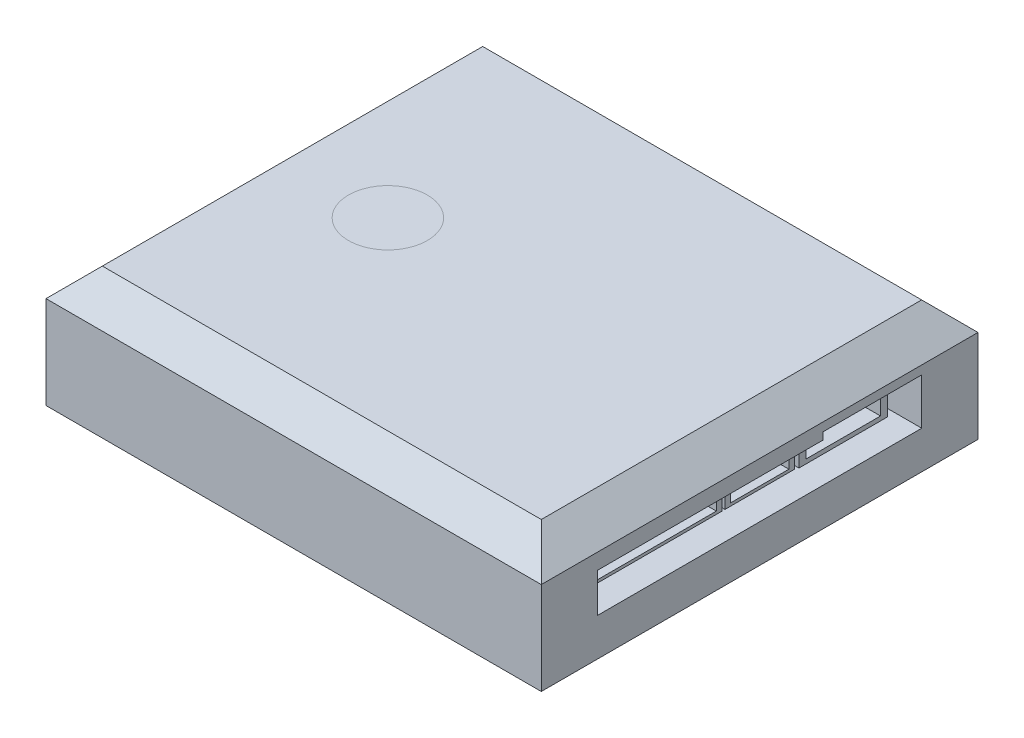
from build123d import *

# Parameters (mm, degrees)
SKETCH1_W            = 43.95
SKETCH1_H            = 38.75
BOSS_EXTRUDE1_DEPTH  = 12.4968
CHAMFER1_SIZE        = 2.5
CHAMFER2_SIZE        = 1.778
SKETCH2_W            = 28.7655
SKETCH2_H            = 3.4671
SKETCH2_W_2          = 8.763
SKETCH2_H_2          = 0.635
CUT_EXTRUDE1_DEPTH   = 6.9342
SKETCH3_W            = 12.5476
SKETCH3_H            = 3.0099
SKETCH3_W_2          = 6.1849
SKETCH3_W_3          = 7.874
SKETCH3_H_2          = 3.8481
BOSS_EXTRUDE2_DEPTH  = 4.6736
CUT_EXTRUDE3_START   = 1.27
CUT_EXTRUDE3_DEPTH   = 3.4036
SKETCH4_R            = 0.1905
SKETCH4_R_2          = 0.254
PINS_DEPTH           = 3.0226
SKETCH6_W            = 4.980118903
SKETCH6_H            = 2.927945053
SKETCH6_W_2          = 6.188094789
CUT_EXTRUDE4_DEPTH   = 7.366
BOSS_EXTRUDE6_START  = -2.286
SKETCH6_7_W          = 4.980118903
SKETCH6_7_H          = 2.927945053
SKETCH6_7_W_2        = 6.188094789
BOSS_EXTRUDE6_DEPTH  = 7.366
BOSS_EXTRUDE7_START  = -5.08
BOSS_EXTRUDE7_DEPTH  = 1.27
SKETCH7_R            = 0.1905
BOSS_EXTRUDE8_DEPTH  = 1.524
SKETCH8_W            = 27.697495277
SKETCH8_H            = 4.307026778
SKETCH8_W_2          = 8.315874778
SKETCH8_H_2          = 3.037026778
SKETCH8_W_3          = 6.16236139
SKETCH8_W_4          = 8.647259109
CUT_EXTRUDE5_DEPTH   = 7.170409787
BOSS_EXTRUDE9_START  = -2.286
SKETCH8_3_W          = 8.315874778
SKETCH8_3_H          = 3.037026778
SKETCH8_3_W_2        = 6.16236139
SKETCH8_3_W_3        = 8.647259109
BOSS_EXTRUDE9_DEPTH  = 4.884409787
BOSS_EXTRUDE10_START = -7.112
BOSS_EXTRUDE10_DEPTH = 1.27
SKETCH9_R            = 0.1905
BOSS_EXTRUDE11_DEPTH = 3.302


with BuildPart() as part:
    # Sketch1 → Boss-Extrude1 (new body)
    with BuildSketch(Plane(origin=(0, 0, 0), x_dir=(1, 0, 0), z_dir=(0, 1, 0))):
        Rectangle(SKETCH1_W, SKETCH1_H)
    extrude(amount=BOSS_EXTRUDE1_DEPTH)

    # Chamfer1
    chamfer1_edges = [part.edges().sort_by_distance(p)[0] for p in [
        (-21.975, 12.4968, 0),
        (0, 12.4968, 19.375),
        (21.975, 12.4968, 0),
        (0, 12.4968, -19.375),
    ]]
    chamfer(chamfer1_edges, length=CHAMFER1_SIZE)

    # Chamfer2
    chamfer2_edges = [part.edges().sort_by_distance(p)[0] for p in [
        (0, 0, 19.375),
        (-21.975, 0, 0),
        (0, 0, -19.375),
        (21.975, 0, 0),
    ]]
    chamfer(chamfer2_edges, length=CHAMFER2_SIZE)

    # Sketch2 → Cut-Extrude1 (cut)
    with BuildSketch(Plane(origin=(21.975, 0, 0), x_dir=(0, 0, -1), z_dir=(1, 0, 0))):
        with Locations((0, 6.86625)):
            Rectangle(SKETCH2_W, SKETCH2_H)
        with Locations((10.00125, 8.9173)):
            Rectangle(SKETCH2_W_2, SKETCH2_H_2)
    extrude(amount=-CUT_EXTRUDE1_DEPTH, mode=Mode.SUBTRACT)

    # Sketch3 → Boss-Extrude2 (add)
    # profile 1 of 6: a face of its own
    with BuildSketch(Plane(origin=(15.0408, 0, 0), x_dir=(0, 0, -1), z_dir=(1, 0, 0))):
        with Locations((-7.34695, 6.86625)):
            Rectangle(SKETCH3_W, SKETCH3_H)
        Polygon((-13.11275, 7.1012), (-13.11275, 5.6153), (-1.58115, 5.6153), (-1.58115, 7.1012), (-1.32715, 7.1012), (-1.32715, 7.6092), (-1.58115, 7.6092), (-1.58115, 8.1172), (-13.11275, 8.1172), (-13.11275, 7.6092), (-13.36675, 7.6092), (-13.36675, 7.1012), align=None, mode=Mode.SUBTRACT)
    # profile 2 of 6: a face of its own
    with BuildSketch(Plane(origin=(15.0408, 0, 0), x_dir=(0, 0, -1), z_dir=(1, 0, 0))):
        Polygon((-13.11275, 7.1012), (-13.36675, 7.1012), (-13.36675, 7.6092), (-13.11275, 7.6092), (-13.11275, 8.1172), (-1.58115, 8.1172), (-1.58115, 7.6092), (-1.32715, 7.6092), (-1.32715, 7.1012), (-1.58115, 7.1012), (-1.58115, 5.6153), (-13.11275, 5.6153), align=None)
    # profile 3 of 6: a face of its own
    with BuildSketch(Plane(origin=(15.0408, 0, 0), x_dir=(0, 0, -1), z_dir=(1, 0, 0))):
        with Locations((2.2733, 6.86625)):
            Rectangle(SKETCH3_W_2, SKETCH3_H)
        Polygon((-0.31115, 7.1012), (-0.31115, 5.6153), (4.85775, 5.6153), (4.85775, 7.1012), (5.11175, 7.1012), (5.11175, 7.6092), (4.85775, 7.6092), (4.85775, 8.1172), (-0.31115, 8.1172), (-0.31115, 7.6092), (-0.56515, 7.6092), (-0.56515, 7.1012), align=None, mode=Mode.SUBTRACT)
    # profile 4 of 6: a face of its own
    with BuildSketch(Plane(origin=(15.0408, 0, 0), x_dir=(0, 0, -1), z_dir=(1, 0, 0))):
        Polygon((-0.31115, 7.1012), (-0.56515, 7.1012), (-0.56515, 7.6092), (-0.31115, 7.6092), (-0.31115, 8.1172), (4.85775, 8.1172), (4.85775, 7.6092), (5.11175, 7.6092), (5.11175, 7.1012), (4.85775, 7.1012), (4.85775, 5.6153), (-0.31115, 5.6153), align=None)
    # profile 5 of 6: a face of its own
    with BuildSketch(Plane(origin=(15.0408, 0, 0), x_dir=(0, 0, -1), z_dir=(1, 0, 0))):
        with Locations((9.68375, 7.18375)):
            Rectangle(SKETCH3_W_3, SKETCH3_H_2)
        Polygon((6.38175, 7.4568), (6.38175, 5.6407), (12.98575, 5.6407), (12.98575, 7.4568), (13.36675, 7.4568), (13.36675, 8.2188), (12.98575, 8.2188), (12.98575, 8.7268), (6.38175, 8.7268), (6.38175, 8.2188), (6.00075, 8.2188), (6.00075, 7.4568), align=None, mode=Mode.SUBTRACT)
    # profile 6 of 6: a face of its own
    with BuildSketch(Plane(origin=(15.0408, 0, 0), x_dir=(0, 0, -1), z_dir=(1, 0, 0))):
        Polygon((6.38175, 7.4568), (6.00075, 7.4568), (6.00075, 8.2188), (6.38175, 8.2188), (6.38175, 8.7268), (12.98575, 8.7268), (12.98575, 8.2188), (13.36675, 8.2188), (13.36675, 7.4568), (12.98575, 7.4568), (12.98575, 5.6407), (6.38175, 5.6407), align=None)
    extrude(amount=BOSS_EXTRUDE2_DEPTH)

    # Sketch3<4> → Cut-Extrude3 (cut)
    with BuildSketch(Plane(origin=(15.0408, 0, 0), x_dir=(0, 0, -1), z_dir=(1, 0, 0)).offset(CUT_EXTRUDE3_START)):
        Polygon((-13.11275, 7.1012), (-13.36675, 7.1012), (-13.36675, 7.6092), (-13.11275, 7.6092), (-13.11275, 8.1172), (-1.58115, 8.1172), (-1.58115, 7.6092), (-1.32715, 7.6092), (-1.32715, 7.1012), (-1.58115, 7.1012), (-1.58115, 5.6153), (-13.11275, 5.6153), align=None)
        Polygon((-0.31115, 7.1012), (-0.56515, 7.1012), (-0.56515, 7.6092), (-0.31115, 7.6092), (-0.31115, 8.1172), (4.85775, 8.1172), (4.85775, 7.6092), (5.11175, 7.6092), (5.11175, 7.1012), (4.85775, 7.1012), (4.85775, 5.6153), (-0.31115, 5.6153), align=None)
        Polygon((6.38175, 7.4568), (6.00075, 7.4568), (6.00075, 8.2188), (6.38175, 8.2188), (6.38175, 8.7268), (12.98575, 8.7268), (12.98575, 8.2188), (13.36675, 8.2188), (13.36675, 7.4568), (12.98575, 7.4568), (12.98575, 5.6407), (6.38175, 5.6407), align=None)
    extrude(amount=CUT_EXTRUDE3_DEPTH, mode=Mode.SUBTRACT)

    # Sketch4 → Pins (add)
    with BuildSketch(Plane(origin=(16.3108, 0, 0), x_dir=(0, 0, -1), z_dir=(1, 0, 0))):
        with Locations((-12.629904443, 7.3552)):
            Circle(SKETCH4_R)
        with Locations((-11.461504443, 7.3552)):
            Circle(SKETCH4_R)
        with Locations((-10.293104443, 7.3552)):
            Circle(SKETCH4_R)
        with Locations((-9.124704443, 7.3552)):
            Circle(SKETCH4_R)
        with Locations((-7.956304443, 7.3552)):
            Circle(SKETCH4_R)
        with Locations((-6.787904443, 7.3552)):
            Circle(SKETCH4_R)
        with Locations((-5.619504443, 7.3552)):
            Circle(SKETCH4_R)
        with Locations((-4.451104443, 7.3552)):
            Circle(SKETCH4_R)
        with Locations((-3.282704443, 7.3552)):
            Circle(SKETCH4_R)
        with Locations((-2.114304443, 7.3552)):
            Circle(SKETCH4_R)
        with Locations((0.343037743, 7.3552)):
            Circle(SKETCH4_R)
        with Locations((2.248037743, 7.3552)):
            Circle(SKETCH4_R)
        with Locations((4.153037743, 7.3552)):
            Circle(SKETCH4_R)
        with Locations((7.146042841, 7.8378)):
            Circle(SKETCH4_R_2)
        with Locations((9.686042841, 7.8378)):
            Circle(SKETCH4_R_2)
        with Locations((12.226042841, 7.8378)):
            Circle(SKETCH4_R_2)
    extrude(amount=PINS_DEPTH)

    # Sketch6 → Cut-Extrude4 (cut)
    # profile 1 of 5: a face of its own
    with BuildSketch(Plane(origin=(0, 0, -19.375), x_dir=(-1, 0, 0), z_dir=(0, 0, -1))):
        Polygon((14.779190213, 9.292249663), (14.779190213, 5.85630461), (5.591422422, 5.85630461), (3.216238929, 5.85630461), (1.578976521, 5.85630461), (1.578976521, 9.292249663), align=None)
        with Locations((4.577035973, 7.574277137)):
            Rectangle(SKETCH6_W, SKETCH6_H, mode=Mode.SUBTRACT)
        with Locations((10.923142819, 7.574277137)):
            Rectangle(SKETCH6_W_2, SKETCH6_H, mode=Mode.SUBTRACT)
    # profile 2 of 5: a face of its own
    with BuildSketch(Plane(origin=(0, 0, -19.375), x_dir=(-1, 0, 0), z_dir=(0, 0, -1))):
        with Locations((4.577035973, 7.574277137)):
            Rectangle(SKETCH6_W, SKETCH6_H)
        Polygon((6.559095424, 7.785668245), (6.813095424, 7.785668245), (6.813095424, 8.293668245), (6.559095424, 8.293668245), (6.559095424, 8.784249663), (2.594976521, 8.784249663), (2.594976521, 8.293668245), (2.340976521, 8.293668245), (2.340976521, 7.785668245), (2.594976521, 7.785668245), (2.594976521, 6.36430461), (6.559095424, 6.36430461), align=None, mode=Mode.SUBTRACT)
    # profile 3 of 5: a face of its own
    with BuildSketch(Plane(origin=(0, 0, -19.375), x_dir=(-1, 0, 0), z_dir=(0, 0, -1))):
        Polygon((6.559095424, 7.785668245), (6.559095424, 6.36430461), (2.594976521, 6.36430461), (2.594976521, 7.785668245), (2.340976521, 7.785668245), (2.340976521, 8.293668245), (2.594976521, 8.293668245), (2.594976521, 8.784249663), (6.559095424, 8.784249663), (6.559095424, 8.293668245), (6.813095424, 8.293668245), (6.813095424, 7.785668245), align=None)
    # profile 4 of 5: a face of its own
    with BuildSketch(Plane(origin=(0, 0, -19.375), x_dir=(-1, 0, 0), z_dir=(0, 0, -1))):
        with Locations((10.923142819, 7.574277137)):
            Rectangle(SKETCH6_W_2, SKETCH6_H)
        Polygon((13.509190213, 7.785668245), (13.763190213, 7.785668245), (13.763190213, 8.293668245), (13.509190213, 8.293668245), (13.509190213, 8.784249663), (8.337095424, 8.784249663), (8.337095424, 8.293668245), (8.083095424, 8.293668245), (8.083095424, 7.785668245), (8.337095424, 7.785668245), (8.337095424, 6.36430461), (13.509190213, 6.36430461), align=None, mode=Mode.SUBTRACT)
    # profile 5 of 5: a face of its own
    with BuildSketch(Plane(origin=(0, 0, -19.375), x_dir=(-1, 0, 0), z_dir=(0, 0, -1))):
        Polygon((13.509190213, 7.785668245), (13.509190213, 6.36430461), (8.337095424, 6.36430461), (8.337095424, 7.785668245), (8.083095424, 7.785668245), (8.083095424, 8.293668245), (8.337095424, 8.293668245), (8.337095424, 8.784249663), (13.509190213, 8.784249663), (13.509190213, 8.293668245), (13.763190213, 8.293668245), (13.763190213, 7.785668245), align=None)
    extrude(amount=-CUT_EXTRUDE4_DEPTH, mode=Mode.SUBTRACT)

    # Sketch6<7> → Boss-Extrude6 (add)
    # profile 1 of 2: a face of its own
    with BuildSketch(Plane(origin=(0, 0, -19.375), x_dir=(-1, 0, 0), z_dir=(0, 0, -1)).offset(BOSS_EXTRUDE6_START)):
        with Locations((4.577035973, 7.574277137)):
            Rectangle(SKETCH6_7_W, SKETCH6_7_H)
        Polygon((6.559095424, 7.785668245), (6.813095424, 7.785668245), (6.813095424, 8.293668245), (6.559095424, 8.293668245), (6.559095424, 8.784249663), (2.594976521, 8.784249663), (2.594976521, 8.293668245), (2.340976521, 8.293668245), (2.340976521, 7.785668245), (2.594976521, 7.785668245), (2.594976521, 6.36430461), (6.559095424, 6.36430461), align=None, mode=Mode.SUBTRACT)
    # profile 2 of 2: a face of its own
    with BuildSketch(Plane(origin=(0, 0, -19.375), x_dir=(-1, 0, 0), z_dir=(0, 0, -1)).offset(BOSS_EXTRUDE6_START)):
        with Locations((10.923142819, 7.574277137)):
            Rectangle(SKETCH6_7_W_2, SKETCH6_7_H)
        Polygon((13.509190213, 7.785668245), (13.763190213, 7.785668245), (13.763190213, 8.293668245), (13.509190213, 8.293668245), (13.509190213, 8.784249663), (8.337095424, 8.784249663), (8.337095424, 8.293668245), (8.083095424, 8.293668245), (8.083095424, 7.785668245), (8.337095424, 7.785668245), (8.337095424, 6.36430461), (13.509190213, 6.36430461), align=None, mode=Mode.SUBTRACT)
    extrude(amount=-BOSS_EXTRUDE6_DEPTH)

    # Sketch6<8> → Boss-Extrude7 (add)
    with BuildSketch(Plane(origin=(0, 0, -19.375), x_dir=(-1, 0, 0), z_dir=(0, 0, -1)).offset(BOSS_EXTRUDE7_START)):
        Polygon((6.559095424, 7.785668245), (6.559095424, 6.36430461), (2.594976521, 6.36430461), (2.594976521, 7.785668245), (2.340976521, 7.785668245), (2.340976521, 8.293668245), (2.594976521, 8.293668245), (2.594976521, 8.784249663), (6.559095424, 8.784249663), (6.559095424, 8.293668245), (6.813095424, 8.293668245), (6.813095424, 7.785668245), align=None)
        Polygon((13.509190213, 7.785668245), (13.509190213, 6.36430461), (8.337095424, 6.36430461), (8.337095424, 7.785668245), (8.083095424, 7.785668245), (8.083095424, 8.293668245), (8.337095424, 8.293668245), (8.337095424, 8.784249663), (13.509190213, 8.784249663), (13.509190213, 8.293668245), (13.763190213, 8.293668245), (13.763190213, 7.785668245), align=None)
    extrude(amount=BOSS_EXTRUDE7_DEPTH)

    # Sketch7 → Boss-Extrude8 (add)
    with BuildSketch(Plane(origin=(0, 0, -15.565), x_dir=(-1, 0, 0), z_dir=(0, 0, -1))):
        with Locations((3.239305638, 8.039668245)):
            Circle(SKETCH7_R)
        with Locations((8.958754307, 8.039668245)):
            Circle(SKETCH7_R)
        with Locations((4.509305638, 8.039668245)):
            Circle(SKETCH7_R)
        with Locations((5.779305638, 8.039668245)):
            Circle(SKETCH7_R)
        with Locations((10.228754307, 8.039668245)):
            Circle(SKETCH7_R)
        with Locations((11.498754307, 8.039668245)):
            Circle(SKETCH7_R)
        with Locations((12.768754307, 8.039668245)):
            Circle(SKETCH7_R)
    extrude(amount=BOSS_EXTRUDE8_DEPTH)

    # Sketch8 → Cut-Extrude5 (cut)
    # profile 1 of 7: a face of its own
    with BuildSketch(Plane.ZY.offset(21.975)):
        with Locations((0.025099221, 7.299711756)):
            Rectangle(SKETCH8_W, SKETCH8_H)
        with Locations((-8.903711028, 7.172711756)):
            Rectangle(SKETCH8_W_2, SKETCH8_H_2, mode=Mode.SUBTRACT)
        with Locations((-0.140592944, 7.172711756)):
            Rectangle(SKETCH8_W_3, SKETCH8_H_2, mode=Mode.SUBTRACT)
        with Locations((8.788217305, 7.172711756)):
            Rectangle(SKETCH8_W_4, SKETCH8_H_2, mode=Mode.SUBTRACT)
    # profile 2 of 7: a face of its own
    with BuildSketch(Plane.ZY.offset(21.975)):
        with Locations((-8.903711028, 7.172711756)):
            Rectangle(SKETCH8_W_2, SKETCH8_H_2)
        Polygon((-12.553648417, 7.433678621), (-12.553648417, 5.908198367), (-5.253773639, 5.908198367), (-5.253773639, 7.433678621), (-4.999773639, 7.433678621), (-4.999773639, 7.941678621), (-5.253773639, 7.941678621), (-5.253773639, 8.437225145), (-12.553648417, 8.437225145), (-12.553648417, 7.941678621), (-12.807648417, 7.941678621), (-12.807648417, 7.433678621), align=None, mode=Mode.SUBTRACT)
    # profile 3 of 7: a face of its own
    with BuildSketch(Plane.ZY.offset(21.975)):
        Polygon((-12.553648417, 7.433678621), (-12.807648417, 7.433678621), (-12.807648417, 7.941678621), (-12.553648417, 7.941678621), (-12.553648417, 8.437225145), (-5.253773639, 8.437225145), (-5.253773639, 7.941678621), (-4.999773639, 7.941678621), (-4.999773639, 7.433678621), (-5.253773639, 7.433678621), (-5.253773639, 5.908198367), (-12.553648417, 5.908198367), align=None)
    # profile 4 of 7: a face of its own
    with BuildSketch(Plane.ZY.offset(21.975)):
        with Locations((-0.140592944, 7.172711756)):
            Rectangle(SKETCH8_W_3, SKETCH8_H_2)
        Polygon((2.432587751, 8.437225145), (2.432587751, 7.941678621), (2.686587751, 7.941678621), (2.686587751, 7.433678621), (2.432587751, 7.433678621), (2.432587751, 5.908198367), (-2.713773639, 5.908198367), (-2.713773639, 7.433678621), (-2.967773639, 7.433678621), (-2.967773639, 7.941678621), (-2.713773639, 7.941678621), (-2.713773639, 8.437225145), align=None, mode=Mode.SUBTRACT)
    # profile 5 of 7: a face of its own
    with BuildSketch(Plane.ZY.offset(21.975)):
        Polygon((2.432587751, 7.941678621), (2.686587751, 7.941678621), (2.686587751, 7.433678621), (2.432587751, 7.433678621), (2.432587751, 5.908198367), (-2.713773639, 5.908198367), (-2.713773639, 7.433678621), (-2.967773639, 7.433678621), (-2.967773639, 7.941678621), (-2.713773639, 7.941678621), (-2.713773639, 8.437225145), (2.432587751, 8.437225145), align=None)
    # profile 6 of 7: a face of its own
    with BuildSketch(Plane.ZY.offset(21.975)):
        with Locations((8.788217305, 7.172711756)):
            Rectangle(SKETCH8_W_4, SKETCH8_H_2)
        Polygon((12.60384686, 7.433678621), (12.85784686, 7.433678621), (12.85784686, 7.941678621), (12.60384686, 7.941678621), (12.60384686, 8.437225145), (4.972587751, 8.437225145), (4.972587751, 7.941678621), (4.718587751, 7.941678621), (4.718587751, 7.433678621), (4.972587751, 7.433678621), (4.972587751, 5.908198367), (12.60384686, 5.908198367), align=None, mode=Mode.SUBTRACT)
    # profile 7 of 7: a face of its own
    with BuildSketch(Plane.ZY.offset(21.975)):
        Polygon((12.60384686, 7.433678621), (12.60384686, 5.908198367), (4.972587751, 5.908198367), (4.972587751, 7.433678621), (4.718587751, 7.433678621), (4.718587751, 7.941678621), (4.972587751, 7.941678621), (4.972587751, 8.437225145), (12.60384686, 8.437225145), (12.60384686, 7.941678621), (12.85784686, 7.941678621), (12.85784686, 7.433678621), align=None)
    extrude(amount=-CUT_EXTRUDE5_DEPTH, mode=Mode.SUBTRACT)

    # Sketch8<3> → Boss-Extrude9 (add)
    # profile 1 of 3: a face of its own
    with BuildSketch(Plane.ZY.offset(21.975).offset(BOSS_EXTRUDE9_START)):
        with Locations((-8.903711028, 7.172711756)):
            Rectangle(SKETCH8_3_W, SKETCH8_3_H)
        Polygon((-12.553648417, 7.433678621), (-12.553648417, 5.908198367), (-5.253773639, 5.908198367), (-5.253773639, 7.433678621), (-4.999773639, 7.433678621), (-4.999773639, 7.941678621), (-5.253773639, 7.941678621), (-5.253773639, 8.437225145), (-12.553648417, 8.437225145), (-12.553648417, 7.941678621), (-12.807648417, 7.941678621), (-12.807648417, 7.433678621), align=None, mode=Mode.SUBTRACT)
    # profile 2 of 3: a face of its own
    with BuildSketch(Plane.ZY.offset(21.975).offset(BOSS_EXTRUDE9_START)):
        with Locations((-0.140592944, 7.172711756)):
            Rectangle(SKETCH8_3_W_2, SKETCH8_3_H)
        Polygon((2.432587751, 8.437225145), (2.432587751, 7.941678621), (2.686587751, 7.941678621), (2.686587751, 7.433678621), (2.432587751, 7.433678621), (2.432587751, 5.908198367), (-2.713773639, 5.908198367), (-2.713773639, 7.433678621), (-2.967773639, 7.433678621), (-2.967773639, 7.941678621), (-2.713773639, 7.941678621), (-2.713773639, 8.437225145), align=None, mode=Mode.SUBTRACT)
    # profile 3 of 3: a face of its own
    with BuildSketch(Plane.ZY.offset(21.975).offset(BOSS_EXTRUDE9_START)):
        with Locations((8.788217305, 7.172711756)):
            Rectangle(SKETCH8_3_W_3, SKETCH8_3_H)
        Polygon((12.60384686, 7.433678621), (12.85784686, 7.433678621), (12.85784686, 7.941678621), (12.60384686, 7.941678621), (12.60384686, 8.437225145), (4.972587751, 8.437225145), (4.972587751, 7.941678621), (4.718587751, 7.941678621), (4.718587751, 7.433678621), (4.972587751, 7.433678621), (4.972587751, 5.908198367), (12.60384686, 5.908198367), align=None, mode=Mode.SUBTRACT)
    extrude(amount=-BOSS_EXTRUDE9_DEPTH)

    # Sketch8<5> → Boss-Extrude10 (add)
    with BuildSketch(Plane.ZY.offset(21.975).offset(BOSS_EXTRUDE10_START)):
        Polygon((-12.553648417, 7.433678621), (-12.807648417, 7.433678621), (-12.807648417, 7.941678621), (-12.553648417, 7.941678621), (-12.553648417, 8.437225145), (-5.253773639, 8.437225145), (-5.253773639, 7.941678621), (-4.999773639, 7.941678621), (-4.999773639, 7.433678621), (-5.253773639, 7.433678621), (-5.253773639, 5.908198367), (-12.553648417, 5.908198367), align=None)
        Polygon((2.432587751, 7.941678621), (2.686587751, 7.941678621), (2.686587751, 7.433678621), (2.432587751, 7.433678621), (2.432587751, 5.908198367), (-2.713773639, 5.908198367), (-2.713773639, 7.433678621), (-2.967773639, 7.433678621), (-2.967773639, 7.941678621), (-2.713773639, 7.941678621), (-2.713773639, 8.437225145), (2.432587751, 8.437225145), align=None)
        Polygon((12.60384686, 7.433678621), (12.60384686, 5.908198367), (4.972587751, 5.908198367), (4.972587751, 7.433678621), (4.718587751, 7.433678621), (4.718587751, 7.941678621), (4.972587751, 7.941678621), (4.972587751, 8.437225145), (12.60384686, 8.437225145), (12.60384686, 7.941678621), (12.85784686, 7.941678621), (12.85784686, 7.433678621), align=None)
    extrude(amount=BOSS_EXTRUDE10_DEPTH)

    # Sketch9 → Boss-Extrude11 (add)
    with BuildSketch(Plane.ZY.offset(16.133)):
        with Locations((-12.099676614, 7.687678621)):
            Circle(SKETCH9_R)
        with Locations((-2.083361744, 7.687678621)):
            Circle(SKETCH9_R)
        with Locations((5.582986841, 7.687678621)):
            Circle(SKETCH9_R)
        with Locations((-10.829676614, 7.687678621)):
            Circle(SKETCH9_R)
        with Locations((-9.559676614, 7.687678621)):
            Circle(SKETCH9_R)
        with Locations((-8.289676614, 7.687678621)):
            Circle(SKETCH9_R)
        with Locations((-7.019676614, 7.687678621)):
            Circle(SKETCH9_R)
        with Locations((-5.749676614, 7.687678621)):
            Circle(SKETCH9_R)
        with Locations((6.852986841, 7.687678621)):
            Circle(SKETCH9_R)
        with Locations((8.122986841, 7.687678621)):
            Circle(SKETCH9_R)
        with Locations((9.392986841, 7.687678621)):
            Circle(SKETCH9_R)
        with Locations((10.662986841, 7.687678621)):
            Circle(SKETCH9_R)
        with Locations((11.932986841, 7.687678621)):
            Circle(SKETCH9_R)
        with Locations((-0.813361744, 7.687678621)):
            Circle(SKETCH9_R)
        with Locations((0.456638256, 7.687678621)):
            Circle(SKETCH9_R)
        with Locations((1.726638256, 7.687678621)):
            Circle(SKETCH9_R)
    extrude(amount=BOSS_EXTRUDE11_DEPTH)


solid = part.part
